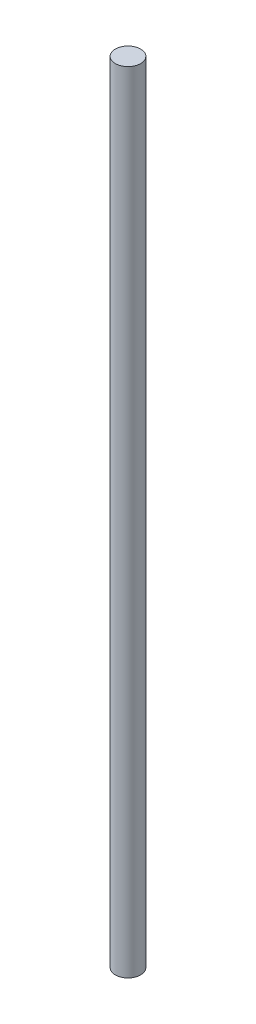
from build123d import *

# Parameters (mm, degrees)
SKETCH_1_R      = 4
EXTRUDE_1_DEPTH = 250


with BuildPart() as part:
    # 草图1 → 凸台-拉伸1 (new body)
    with BuildSketch(Plane(origin=(0, 0, 0), x_dir=(1, 0, 0), z_dir=(0, 1, 0))):
        with Locations(Location((0, 0, 0), (0, 0, 270))):
            Circle(SKETCH_1_R)
    extrude(amount=EXTRUDE_1_DEPTH)


solid = part.part
